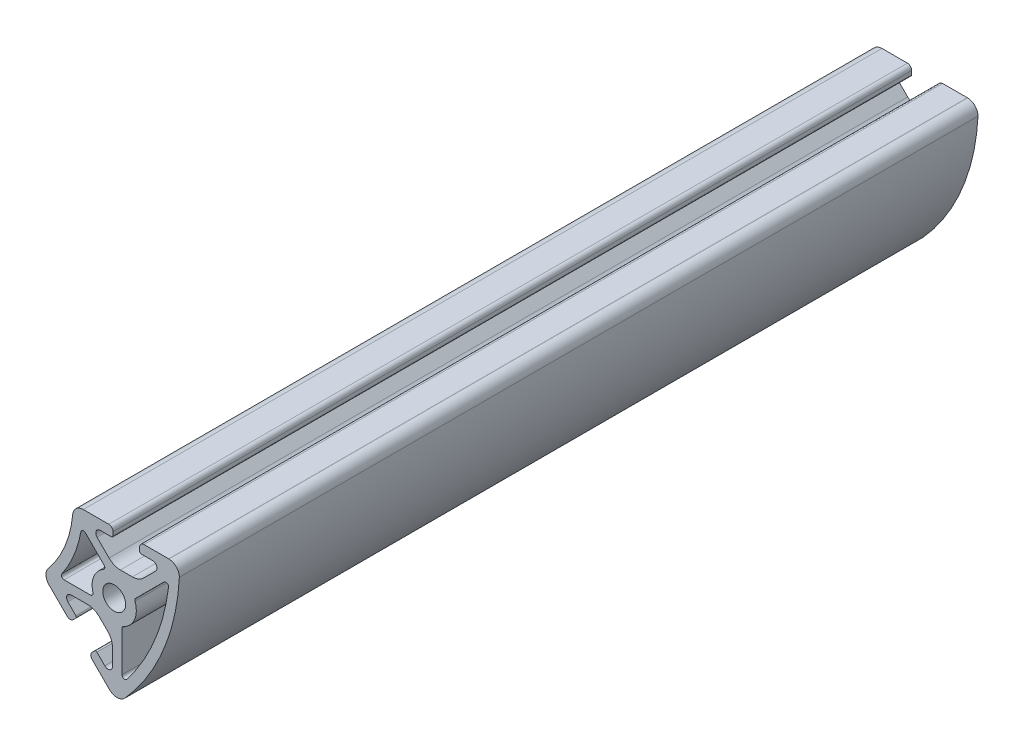
from build123d import *

# Parameters (mm, degrees)
BOSS_EXTRUDE1_DEPTH = 150


with BuildPart() as part:
    # Sketch1 → Boss-Extrude1 (new body)
    with BuildSketch(Plane.XY):
        with BuildLine():
            Line((-17.933849058, 1.310471954), (-17.438874304, 1.805446694))
            ThreePointArc((-17.438874304, 1.805446694), (-17.351006338, 2.017578728), (-17.438874304, 2.229710762))
            Line((-17.438874304, 2.229710762), (-18.936235421, 3.72707188))
            ThreePointArc((-18.936235421, 3.72707188), (-19.116679575, 4.6342259), (-18.347631531, 5.148087374))
            Line((-18.347631531, 5.148087374), (-15.165219907, 5.148087374))
            ThreePointArc((-15.165219907, 5.148087374), (-14.01716961, 4.919725971), (-13.043899564, 4.269407717))
            Line((-13.043899564, 4.269407717), (-11.439379376, 2.66488753))
            ThreePointArc((-11.439379376, 2.66488753), (-10.789061123, 1.691617485), (-10.560699721, 0.54356719))
            Line((-10.560699721, 0.54356719), (-10.560699721, -2.638844434))
            ThreePointArc((-10.560699721, -2.638844434), (-11.074561199, -3.407892483), (-11.981715225, -3.227448328))
            Line((-11.981715225, -3.227448328), (-13.479076343, -1.730087211))
            ThreePointArc((-13.479076343, -1.730087211), (-13.691208377, -1.642219245), (-13.903340412, -1.730087211))
            Line((-13.903340412, -1.730087211), (-14.398315158, -2.225061958))
            ThreePointArc((-14.398315158, -2.225061958), (-14.632629733, -2.790747383), (-14.398315158, -3.356432808))
            Line((-14.398315158, -3.356432808), (-11.091426526, -6.66332144))
            Line((-11.091426526, -6.66332144), (-11.021736276, -6.72655883))
            ThreePointArc((-11.021736276, -6.72655883), (-9.637071865, -7.232037367), (-8.282153045, -6.651521154))
            ThreePointArc((-8.282153045, -6.651521154), (-0.986587883, 4.879678298), (2.008460712, 18.19221058))
            ThreePointArc((2.008460712, 18.19221058), (1.440783284, 19.581695132), (0.06638279, 20.184976381))
            ThreePointArc((0.06638279, 20.184976381), (0.035983891, 20.186304583), (0.00556439, 20.187019567))
            Line((0.00556439, 20.187019567), (-4.64176753, 20.187019567))
            ThreePointArc((-4.64176753, 20.187019567), (-5.207452955, 19.952704992), (-5.44176753, 19.387019567))
            Line((-5.44176753, 19.387019567), (-5.44176754, 18.687019567))
            ThreePointArc((-5.44176754, 18.687019567), (-5.353899574, 18.474887532), (-5.14176754, 18.387019567))
            Line((-5.14176754, 18.387019567), (-3.02417914, 18.387019567))
            ThreePointArc((-3.02417914, 18.387019567), (-2.255131096, 17.873158092), (-2.43557525, 16.966004073))
            Line((-2.43557525, 16.966004073), (-4.68588009, 14.715699233))
            ThreePointArc((-4.68588009, 14.715699233), (-5.659150136, 14.065380979), (-6.807200433, 13.837019576))
            Line((-6.807200433, 13.837019576), (-9.076334643, 13.837019576))
            ThreePointArc((-9.076334643, 13.837019576), (-10.224384938, 14.065380978), (-11.197654983, 14.715699231))
            Line((-11.197654983, 14.715699231), (-13.447959823, 16.966004071))
            ThreePointArc((-13.447959823, 16.966004071), (-13.628403978, 17.873158097), (-12.859355929, 18.387019575))
            Line((-12.859355929, 18.387019575), (-10.741767529, 18.387019575))
            ThreePointArc((-10.741767529, 18.387019575), (-10.529635495, 18.474887541), (-10.441767529, 18.687019575))
            Line((-10.441767529, 18.687019575), (-10.441767529, 19.387019575))
            ThreePointArc((-10.441767529, 19.387019575), (-10.676082104, 19.952705), (-11.241767529, 20.187019575))
            Line((-11.241767529, 20.187019575), (-16.032865229, 20.187019575))
            ThreePointArc((-16.032865229, 20.187019575), (-17.381264954, 19.664117467), (-18.02458362, 18.368837756))
            ThreePointArc((-18.02458362, 18.368837756), (-19.464176878, 12.533350929), (-22.57254303, 7.389092466))
            ThreePointArc((-22.57254303, 7.389092466), (-23.035584519, 6.097289793), (-22.557062201, 4.811141295))
            Line((-22.557062201, 4.811141295), (-22.41767475, 4.662926796))
            Line((-22.41767475, 4.662926796), (-19.065219908, 1.310471954))
            ThreePointArc((-19.065219908, 1.310471954), (-18.499534483, 1.076157379), (-17.933849058, 1.310471954))
        make_face()
        with BuildLine():
            Line((-12.14365631, 13.117817809), (-15.63660261, 16.610764109))
            ThreePointArc((-15.63660261, 16.610764109), (-16.139874769, 16.734268673), (-16.482327269, 16.345343836))
            ThreePointArc((-16.482327269, 16.345343836), (-17.800420542, 11.845449218), (-20.050293851, 7.731510528))
            ThreePointArc((-20.050293851, 7.731510528), (-20.083154751, 7.214348654), (-19.63995668, 6.945812413))
            Line((-19.63995668, 6.945812413), (-14.70018465, 6.945812413))
            ThreePointArc((-14.70018465, 6.945812413), (-14.301543386, 7.144009261), (-14.21893989, 7.581471843))
            ThreePointArc((-14.21893989, 7.581471843), (-14.058708433, 10.295581323), (-12.252843967, 12.328047292))
            ThreePointArc((-12.252843967, 12.328047292), (-12.001920705, 12.695789539), (-12.14365631, 13.117817809))
        make_face(mode=Mode.SUBTRACT)
        with BuildLine():
            Line((-0.870882283, 15.9852679), (-6.207568998, 10.648581185))
            ThreePointArc((-6.207568998, 10.648581185), (-6.342128781, 10.40340459), (-6.323971818, 10.124319975))
            ThreePointArc((-6.323971818, 10.124319975), (-6.390508312, 7.119308828), (-8.468323669, 4.947396666))
            ThreePointArc((-8.468323669, 4.947396666), (-8.678505203, 4.762892953), (-8.7567231, 4.494378786))
            Line((-8.7567231, 4.494378786), (-8.7567231, -3.052835944))
            ThreePointArc((-8.7567231, -3.052835944), (-8.419748711, -3.525511996), (-7.8630325, -3.361069154))
            ThreePointArc((-7.8630325, -3.361069154), (-2.648796205, 5.569440932), (-0.020993808, 15.571287015))
            ThreePointArc((-0.020993808, 15.571287015), (-0.298372973, 16.081223462), (-0.870882283, 15.9852679))
        make_face(mode=Mode.SUBTRACT)
        with BuildLine():
            ThreePointArc((-12.37538155, 8.706516606), (-10.22538155, 6.556516606), (-8.07538155, 8.706516606))
            ThreePointArc((-8.07538155, 8.706516606), (-10.22538155, 10.856516606), (-12.37538155, 8.706516606))
        make_face(mode=Mode.SUBTRACT)
    extrude(amount=BOSS_EXTRUDE1_DEPTH)


solid = part.part
